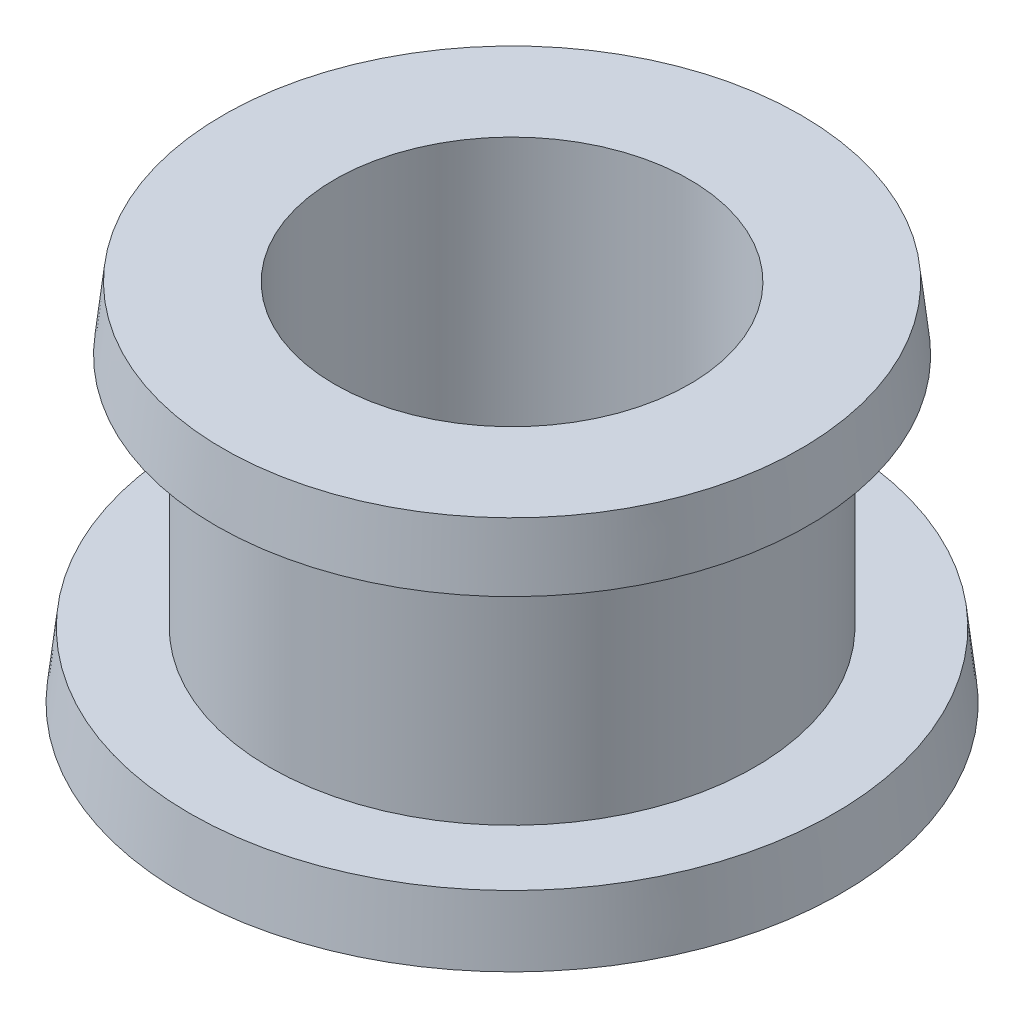
from build123d import *

# Parameters (mm, degrees)
SKETCH_2_R          = 1.5
CUT_EXTRUDE_1_DEPTH = 6.00305692


with BuildPart() as part:
    # 草图1 → 旋转1 (revolve)
    with BuildSketch(Plane.XY, mode=Mode.PRIVATE) as revolve_1_sk:
        Polygon((0, 2.856769339), (2.442991795, 2.856769339), (2.502629957, 2.321682492), (2.049739135, 2.321682492), (2.049739135, 0.327040742), (2.724942969, 0.327040742), (2.786537516, -0.225599214), (0, -0.225599214), align=None)
    revolve(revolve_1_sk.sketch.rotate(Axis((0, 0, 0), (0, 1, 0)), 90), axis=Axis((0, 0, 0), (0, 1, 0)))

    # 草图2 → 切除-拉伸1 (cut, through all)
    with BuildSketch(Plane(origin=(0, 2.856769339, 0), x_dir=(1, 0, 0), z_dir=(0, 1, 0))):
        with Locations(Location((0, 0, 0), (0, 0, 270))):
            Circle(SKETCH_2_R)
    extrude(amount=-CUT_EXTRUDE_1_DEPTH, mode=Mode.SUBTRACT)


solid = part.part
